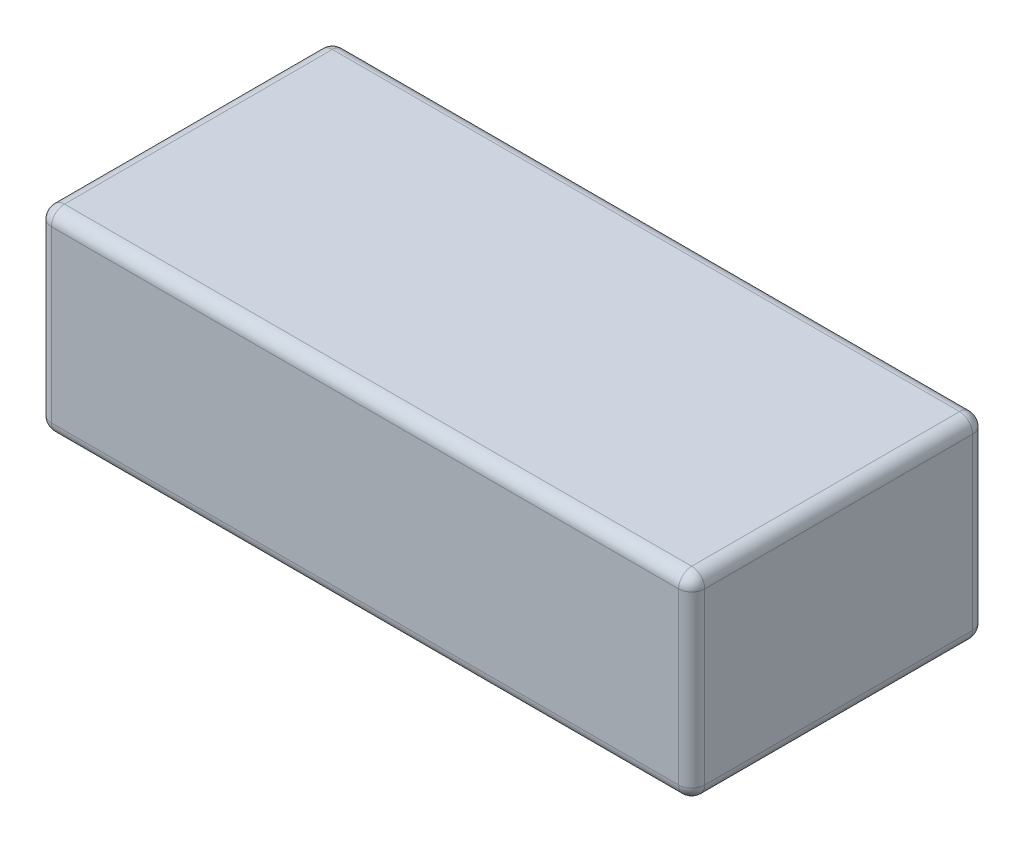
from build123d import *

# Parameters (mm, degrees)
SKETCH1_W           = 100
SKETCH1_H           = 45
BOSS_EXTRUDE1_DEPTH = 30
FILLET1_R           = 2


with BuildPart() as part:
    # Sketch1 → Boss-Extrude1 (new body)
    with BuildSketch(Plane(origin=(0, 0, 0), x_dir=(1, 0, 0), z_dir=(0, 1, 0))):
        with Locations((50, 22.5)):
            Rectangle(SKETCH1_W, SKETCH1_H)
    extrude(amount=BOSS_EXTRUDE1_DEPTH)

    # Fillet1
    fillet1_edges = [part.edges().sort_by_distance(p)[0] for p in [
        (100, 30, -22.5),
        (50, 30, -45),
        (0, 30, -22.5),
        (50, 0, -45),
        (100, 0, -22.5),
        (50, 0, 0),
        (0, 0, -22.5),
        (50, 30, 0),
        (0, 15, -45),
        (100, 15, -45),
        (100, 15, 0),
        (0, 15, 0),
    ]]
    fillet(fillet1_edges, radius=FILLET1_R)


solid = part.part
